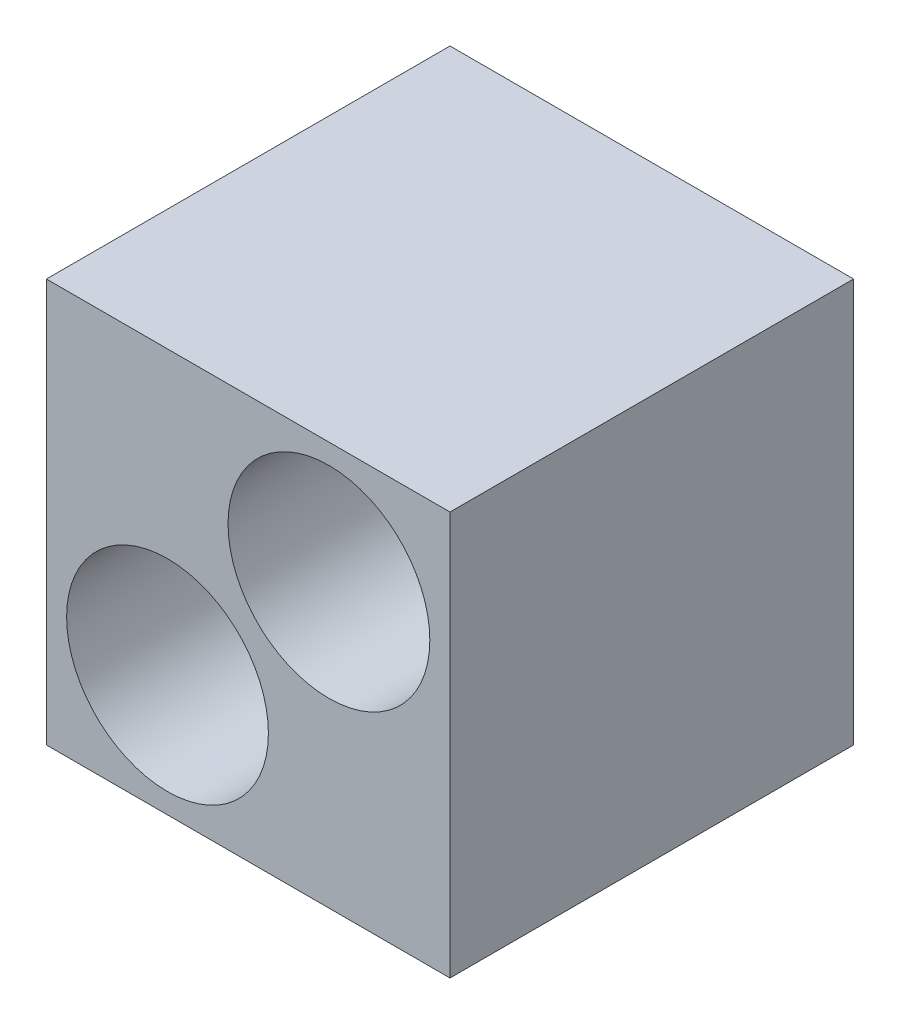
from build123d import *

# Parameters (mm, degrees)
SKETCH1_W           = 10
SKETCH1_H           = 10
BOSS_EXTRUDE1_DEPTH = 10
SKETCH2_R           = 2.5
CUT_EXTRUDE1_DEPTH  = 18.320508076
SKETCH3_R           = 2.5
CUT_EXTRUDE2_DEPTH  = 18.320508076


with BuildPart() as part:
    # Sketch1 → Boss-Extrude1 (new body)
    with BuildSketch(Plane.XY):
        with Locations((5, 5)):
            Rectangle(SKETCH1_W, SKETCH1_H)
    extrude(amount=BOSS_EXTRUDE1_DEPTH)

    # Sketch2 → Cut-Extrude1 (cut, through all)
    with BuildSketch(Plane.XY.offset(10)):
        with Locations((3, 3)):
            Circle(SKETCH2_R)
    extrude(amount=-CUT_EXTRUDE1_DEPTH, mode=Mode.SUBTRACT)

    # Sketch3 → Cut-Extrude2 (cut, through all)
    with BuildSketch(Plane.XY.offset(10)):
        with Locations((7, 7)):
            Circle(SKETCH3_R)
    extrude(amount=-CUT_EXTRUDE2_DEPTH, mode=Mode.SUBTRACT)


solid = part.part
